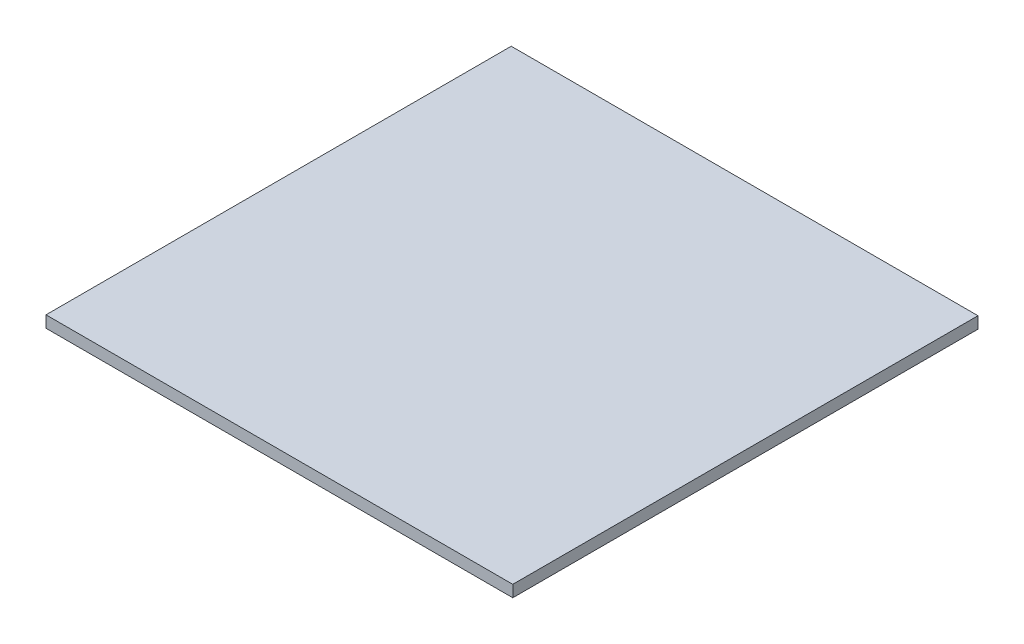
from build123d import *

# Parameters (mm, degrees)
SKETCH1_W           = 1200
SKETCH1_H           = 1196
BOSS_EXTRUDE1_DEPTH = 30


with BuildPart() as part:
    # Sketch1 → Boss-Extrude1 (new body)
    with BuildSketch(Plane(origin=(0, 0, 0), x_dir=(1, 0, 0), z_dir=(0, 1, 0))):
        Rectangle(SKETCH1_W, SKETCH1_H)
    extrude(amount=BOSS_EXTRUDE1_DEPTH)


solid = part.part
